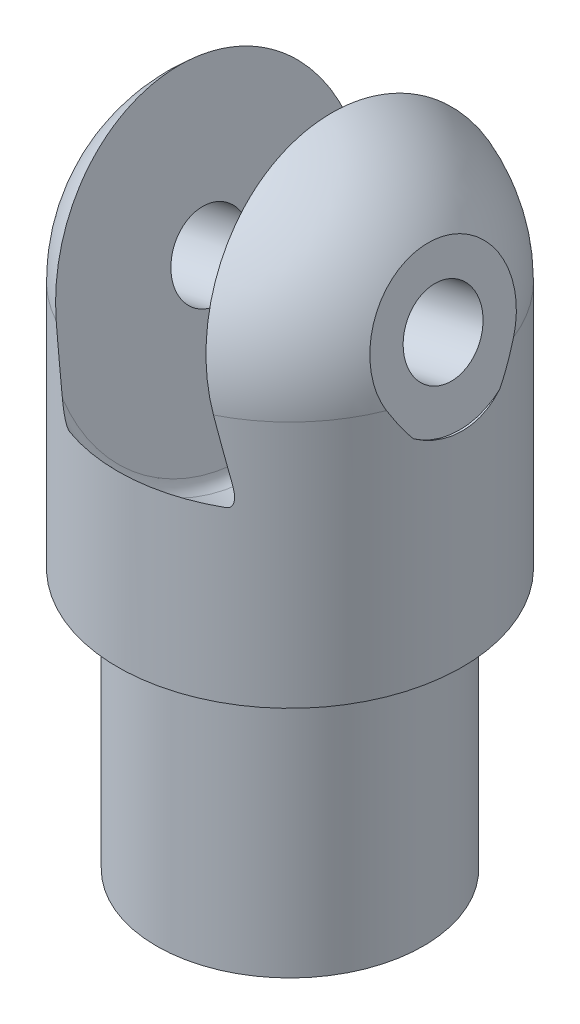
from build123d import *

# Parameters (mm, degrees)
SKETCH1_R                     = 12.9921
BOSS_EXTRUDE1_DEPTH           = 25.4
CUT_EXTRUDE1_DEPTH            = 104.344307451
CUT_EXTRUDE1_DEPTH_BACK       = 104.344307451
SKETCH3_R                     = 3.81
CUT_REVOLVE10_ANGLE           = 90
CUT_REVOLVE10_OTHER_WAY_ANGLE = 180
CUT_EXTRUDE4_DEPTH            = 32.004
FILLET1_R                     = 1.27
SKETCH15_R                    = 7.62
CUT_EXTRUDE5_DEPTH            = 10.16


with BuildPart() as part:
    # Sketch1 → Boss-Extrude1 (new body)
    with BuildSketch(Plane(origin=(0, 0, 0), x_dir=(1, 0, 0), z_dir=(0, 1, 0))):
        Circle(SKETCH1_R)
    extrude(amount=BOSS_EXTRUDE1_DEPTH)

    # Sketch2 → Revolve1 (revolve)
    with BuildSketch(Plane(origin=(0, 0, 0), x_dir=(0, 0, -1), z_dir=(1, 0, 0))):
        with BuildLine():
            Line((-16.764, 25.4), (-16.764, 49.53))
            ThreePointArc((-16.764, 49.53), (-11.85393808, 61.38393808), (0, 66.294))
            Line((0, 66.294), (0, 25.4))
            Line((0, 25.4), (-16.764, 25.4))
        make_face()
    revolve(axis=Axis((0, 25.4, 0), (0, 1, 0)))

    # Sketch3 → Cut-Extrude1 (cut, two sides: drawn at the far end of the back side and taken through both)
    with BuildSketch(Plane(origin=(-10.366451402, 98.300319395, 0), x_dir=(0, 0, -1), z_dir=(-0.9781476007338062, -0.20791169081775643, 0)).offset(-CUT_EXTRUDE1_DEPTH_BACK)):
        with Locations((0, 49.859877342)):
            Circle(SKETCH3_R)
    extrude(amount=CUT_EXTRUDE1_DEPTH + CUT_EXTRUDE1_DEPTH_BACK, mode=Mode.SUBTRACT)

    # Sketch11 → Cut-Revolve10 (revolve, cut)
    with BuildSketch(Plane.XY):
        with BuildLine():
            Line((-7.701934208, 47.892903347), (-11.162976054, 64.175825024))
            ThreePointArc((-11.162976054, 64.175825024), (-4.101170935, 67.482510185), (3.695979409, 67.570287171))
            Line((3.695979409, 67.570287171), (7.205035227, 51.061477515))
            Line((7.205035227, 51.061477515), (-7.701934208, 47.892903347))
        make_face()
    revolve(axis=Axis((17.487516564, 53.247086393, 0), (-0.9781476007338064, -0.2079116908177564, 0)), revolution_arc=CUT_REVOLVE10_ANGLE, mode=Mode.SUBTRACT)

    # Sketch11 → Cut-Revolve10 other way (revolve, cut)
    with BuildSketch(Plane.XY):
        with BuildLine():
            Line((-7.701934208, 47.892903347), (-11.162976054, 64.175825024))
            ThreePointArc((-11.162976054, 64.175825024), (-4.101170935, 67.482510185), (3.695979409, 67.570287171))
            Line((3.695979409, 67.570287171), (7.205035227, 51.061477515))
            Line((7.205035227, 51.061477515), (-7.701934208, 47.892903347))
        make_face()
    revolve(axis=Axis((17.487516564, 53.247086393, 0), (0.9781476007338064, 0.2079116908177564, 0)), revolution_arc=CUT_REVOLVE10_OTHER_WAY_ANGLE, mode=Mode.SUBTRACT)

    # Sketch13 → Cut-Revolve11 (revolve, cut)
    with BuildSketch(Plane.XY):
        with BuildLine():
            Line((-8.49407775, 51.619645705), (6.412891685, 54.788219873))
            Line((6.412891685, 54.788219873), (2.927360083, 71.186356794))
            ThreePointArc((2.927360083, 71.186356794), (-4.869286819, 71.216520857), (-11.979609352, 68.017782626))
            Line((-11.979609352, 68.017782626), (-8.49407775, 51.619645705))
        make_face()
    revolve(axis=Axis((-8.49407775, 51.619645705, 0), (0.9781476007338064, 0.20791169081775637, 0)), mode=Mode.SUBTRACT)

    # Sketch14 → Cut-Extrude4 (cut)
    with BuildSketch(Plane.XY):
        with BuildLine():
            Line((-7.701934208, 47.892903347), (-6.149656223, 40.590009601))
            ThreePointArc((-6.149656223, 40.590009601), (1.969552427, 39.042311826), (8.757313212, 43.758583769))
            Line((8.757313212, 43.758583769), (7.205035227, 51.061477515))
            Line((7.205035227, 51.061477515), (-7.701934208, 47.892903347))
        make_face()
    extrude(amount=-CUT_EXTRUDE4_DEPTH, mode=Mode.SUBTRACT)

    # Fillet1
    fillet1_edges = [part.edges().sort_by_distance(p)[0] for p in [
        (-4.840027967, 34.428693074, 9.361457334),
        (-5.306564153, 36.623573262, -6.782727573),
        (-6.149656223, 40.590009601, -14.000445211),
        (8.757313212, 43.758583769, -13.350191985),
        (9.600405282, 39.79214743, -6.782727573),
        (10.298585015, 36.507470038, 7.966497668),
    ]]
    fillet(fillet1_edges, radius=FILLET1_R)

    # Sketch15 → Cut-Extrude5 (cut)
    with BuildSketch(Plane(origin=(-4.834136469, -1.027527427, 0), x_dir=(0, 0, -1), z_dir=(-0.9781476007338062, -0.20791169081775643, 0))):
        with Locations((0, -48.447650664)):
            Circle(SKETCH15_R)
    cut_extrude5 = extrude(amount=CUT_EXTRUDE5_DEPTH, mode=Mode.SUBTRACT)

    # Mirror1: Cut-Extrude5 across plane
    add(cut_extrude5.mirror(Plane(origin=(10.072832966, 2.141046741, 0), x_dir=(0, 0, 1), z_dir=(-0.9781476007338062, -0.20791169081775643, 0))), mode=Mode.SUBTRACT)


solid = part.part
